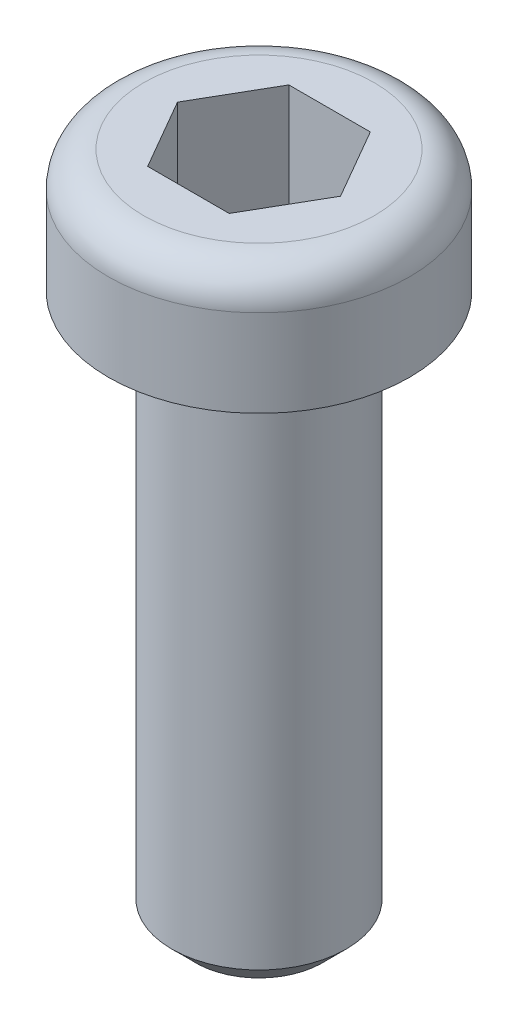
from build123d import *

# Parameters (mm, degrees)
SKETCH1_R           = 3.2
BOSS_EXTRUDE1_DEPTH = 2.6
FILLET1_R           = 0.75
SKETCH2_R           = 1.85
BOSS_EXTRUDE2_DEPTH = 11.7
CHAMFER1_SIZE       = 0.5


with BuildPart() as part:
    # Sketch1 → Boss-Extrude1 (new body)
    with BuildSketch(Plane(origin=(0, 0, 0), x_dir=(1, 0, 0), z_dir=(0, 1, 0))):
        with Locations(Location((0, 0, 0), (0, 0, 270))):
            Circle(SKETCH1_R)
        Polygon((1.732050808, 0), (0.866025404, 1.5), (-0.866025404, 1.5), (-1.732050808, 0), (-0.866025404, -1.5), (0.866025404, -1.5), align=None, mode=Mode.SUBTRACT)
    extrude(amount=BOSS_EXTRUDE1_DEPTH)

    # Fillet1
    fillet1_edges = [part.edges().sort_by_distance(p)[0] for p in [
        (0, 2.6, -3.2),
    ]]
    fillet(fillet1_edges, radius=FILLET1_R)

    # Sketch2 → Boss-Extrude2 (add)
    with BuildSketch(Plane.XZ):
        with Locations(Location((0, 0, 0), (0, 0, 90))):
            Circle(SKETCH2_R)
    extrude(amount=BOSS_EXTRUDE2_DEPTH)

    # Chamfer1
    chamfer1_edges = [part.edges().sort_by_distance(p)[0] for p in [
        (0, -11.7, -1.85),
    ]]
    chamfer(chamfer1_edges, length=CHAMFER1_SIZE)


solid = part.part
